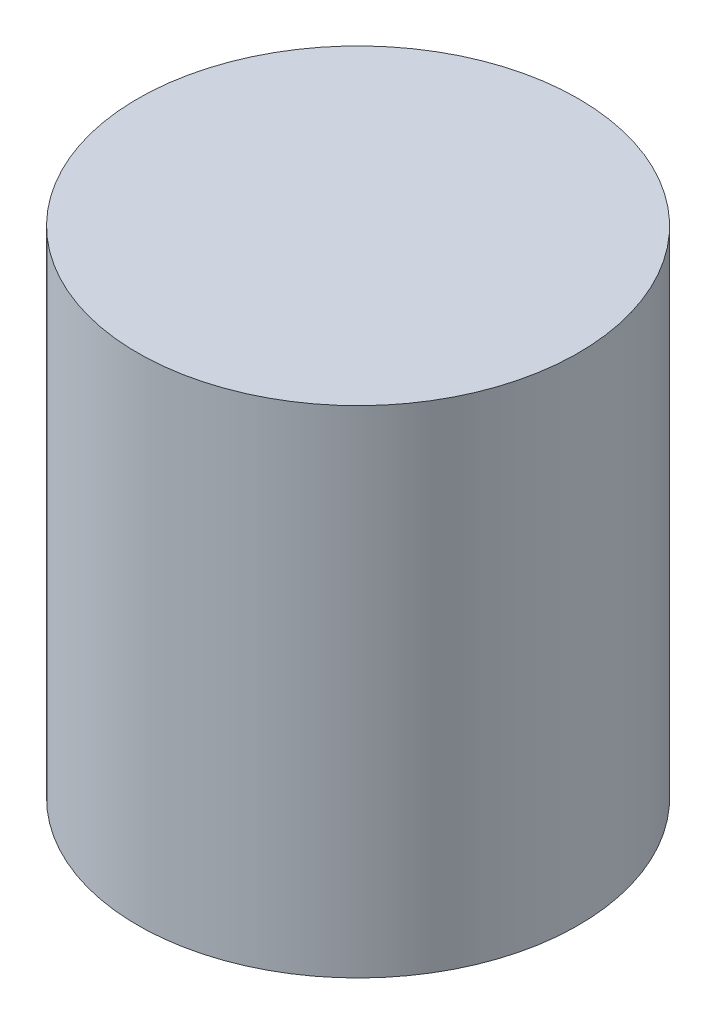
from build123d import *

# Parameters (mm, degrees)
ESQUISSE2_R             = 40
BOSS_EXTRU_1_DEPTH      = 90
ESQUISSE3_R             = 25
ENL_V_MAT_EXTRU_1_DEPTH = 70


with BuildPart() as part:
    # Esquisse2 → Boss.-Extru.1 (new body)
    with BuildSketch(Plane(origin=(0, 0, 0), x_dir=(1, 0, 0), z_dir=(0, 1, 0))):
        with Locations(Location((0, 0, 0), (0, 0, 90))):
            Circle(ESQUISSE2_R)
    extrude(amount=BOSS_EXTRU_1_DEPTH)

    # Esquisse3 → Enlèv. mat.-Extru.1 (cut)
    with BuildSketch(Plane.XZ):
        with Locations(Location((0, 0, 0), (0, 0, 270))):
            Circle(ESQUISSE3_R)
    extrude(amount=-ENL_V_MAT_EXTRU_1_DEPTH, mode=Mode.SUBTRACT)


solid = part.part
